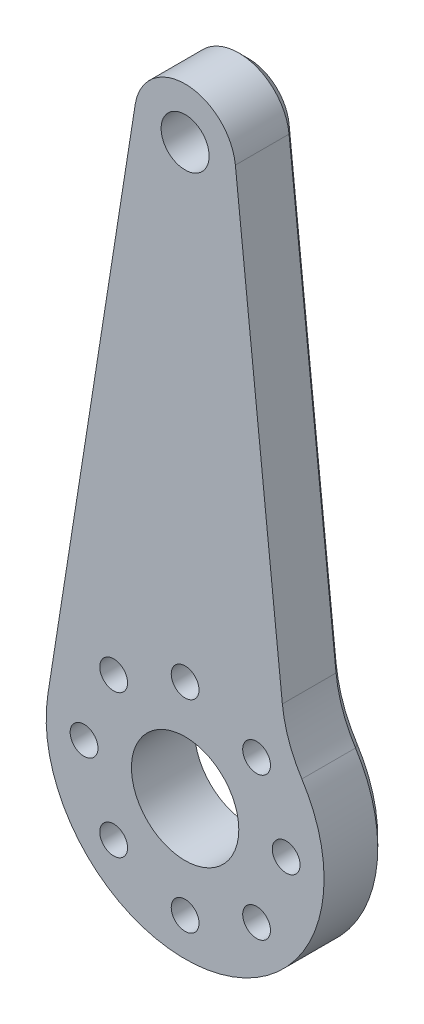
from build123d import *
from build123d.topology import SkipClean

# Parameters (mm, degrees)
SKETCH1_R             = 1.9
SKETCH1_R_2           = 4.25
SKETCH1_R_3           = 1.1
BOSS_EXTRUDE1_DEPTH   = 5
SKETCH4_R             = 1.75
CUT_EXTRUDE3_DEPTH    = 2.25
CORTAR_EXTRUIR1_DEPTH = 10
REDONDEO1_R           = 10
CHAFL_N1_SIZE         = 0.75


with BuildPart() as part:
    # Sketch1 → Boss-Extrude1 (new body)
    with BuildSketch(Plane.XY):
        with BuildLine():
            Line((-18.975518457, 25.487207509), (-25.890308475, -18.423903602))
            ThreePointArc((-25.890308475, -18.423903602), (-15.024209876, -31.135014713), (-4.158111277, -18.423903602))
            Line((-4.158111277, -18.423903602), (-11.072901294, 25.487207509))
            ThreePointArc((-11.072901294, 25.487207509), (-15.024209876, 28.864985287), (-18.975518457, 25.487207509))
        make_face()
        with Locations((-15.024209876, 24.864985287)):
            Circle(SKETCH1_R, mode=Mode.SUBTRACT)
        with Locations((-15.024209876, -20.135014713)):
            Circle(SKETCH1_R_2, mode=Mode.SUBTRACT)
        with Locations((-7.024209876, -20.135014713)):
            Circle(SKETCH1_R_3, mode=Mode.SUBTRACT)
        with Locations((-9.367355626, -25.791868962)):
            Circle(SKETCH1_R_3, mode=Mode.SUBTRACT)
        with Locations((-15.024209876, -28.135014713)):
            Circle(SKETCH1_R_3, mode=Mode.SUBTRACT)
        with Locations((-20.681064125, -25.791868962)):
            Circle(SKETCH1_R_3, mode=Mode.SUBTRACT)
        with Locations((-23.024209876, -20.135014713)):
            Circle(SKETCH1_R_3, mode=Mode.SUBTRACT)
        with Locations((-20.681064125, -14.478160463)):
            Circle(SKETCH1_R_3, mode=Mode.SUBTRACT)
        with Locations((-15.024209876, -12.135014713)):
            Circle(SKETCH1_R_3, mode=Mode.SUBTRACT)
        with Locations((-9.367355626, -14.478160463)):
            Circle(SKETCH1_R_3, mode=Mode.SUBTRACT)
    extrude(amount=BOSS_EXTRUDE1_DEPTH)

    # Sketch4 → Cut-Extrude3 (cut)
    with BuildSketch(Plane(origin=(0, 0, 0), x_dir=(-1, 0, 0), z_dir=(0, 0, -1))):
        with Locations((23.024209876, -20.135014713)):
            Circle(SKETCH4_R)
        with Locations((20.681064125, -25.791868962)):
            Circle(SKETCH4_R)
        with Locations((15.024209876, -28.135014713)):
            Circle(SKETCH4_R)
        with Locations((9.367355626, -25.791868962)):
            Circle(SKETCH4_R)
        with Locations((7.024209876, -20.135014713)):
            Circle(SKETCH4_R)
        with Locations((9.367355626, -14.478160463)):
            Circle(SKETCH4_R)
        with Locations((15.024209876, -12.135014713)):
            Circle(SKETCH4_R)
        with Locations((20.681064125, -14.478160463)):
            Circle(SKETCH4_R)
    extrude(amount=-CUT_EXTRUDE3_DEPTH, mode=Mode.SUBTRACT)

    # Croquis1 → Cortar-Extruir1 (cut)
    with SkipClean():  # the faces are left unmerged after this step: merging them gives an invalid solid
        with BuildSketch(Plane(origin=(0, 0, 0), x_dir=(-1, 0, 0), z_dir=(0, 0, -1))):
            with BuildLine():
                Line((11.046495908, 25.286638687), (7.032909488, -12.57597257))
                ThreePointArc((7.032909488, -12.57597257), (5.15253583, -15.282175181), (4.158111277, -18.423903602))
                Line((4.158111277, -18.423903602), (11.072901294, 25.487207509))
                ThreePointArc((11.072901294, 25.487207509), (11.05843043, 25.387090056), (11.046495908, 25.286638687))
            make_face()
        extrude(amount=-CORTAR_EXTRUIR1_DEPTH, mode=Mode.SUBTRACT)

    # Redondeo1
    redondeo1_edges = [part.edges().sort_by_distance(p)[0] for p in [
        (-7.032909488, -12.57597257, 2.5),
    ]]
    fillet(redondeo1_edges, radius=REDONDEO1_R)

    # Chaflán1
    chafl_n1_edges = [part.edges().sort_by_distance(p)[0] for p in [
        (-9.187032597, 7.74518595, 0),
        (-6.81242829, -12.072485352, 0),
        (-15.024209876, -31.135014713, 0),
        (-22.432913466, 3.531651954, 0),
        (-15.024209876, 28.864985287, 0),
    ]]
    chamfer(chafl_n1_edges, length=CHAFL_N1_SIZE)


solid = part.part
